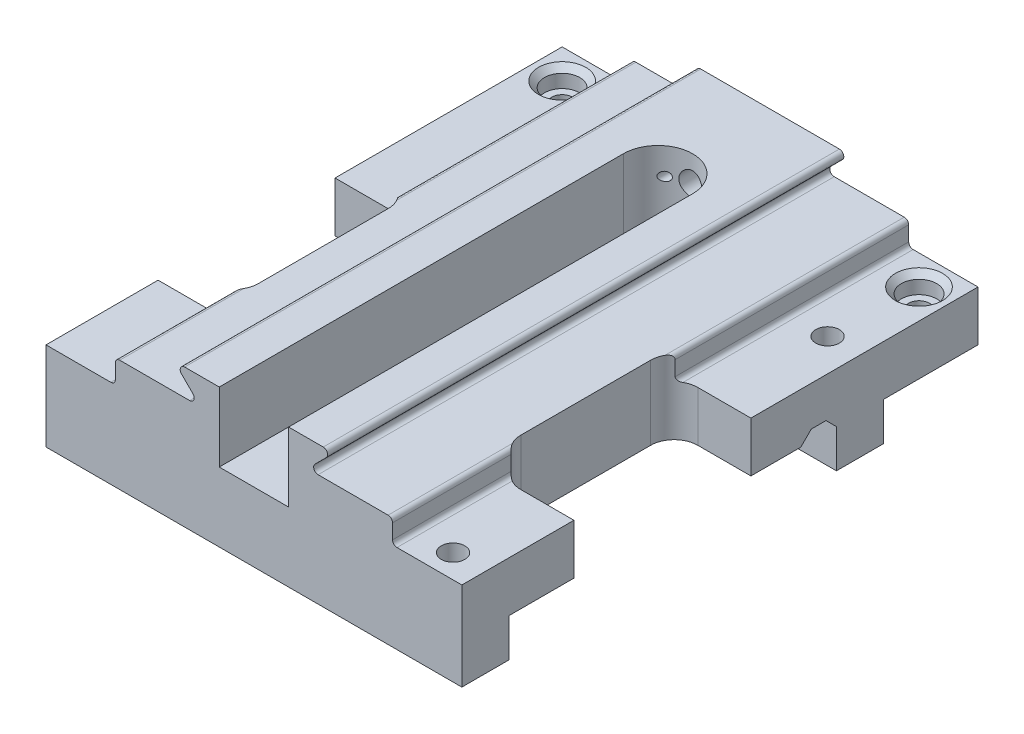
from build123d import *

# Parameters (mm, degrees)
SKETCH1_R               = 4
SKETCH1_R_2             = 1.5
BOSS_EXTRUDE1_DEPTH     = 175
SKETCH2_R               = 6
CUT_EXTRUDE1_DEPTH      = 191.124958909
CUT_EXTRUDE2_DEPTH      = 191.124959013
CUT_EXTRUDE2_DEPTH_BACK = 191.124959013
SKETCH3_R               = 3.5
SKETCH3_R_2             = 5
CUT_EXTRUDE3_DEPTH      = 191.124959013
CUT_EXTRUDE3_DEPTH_BACK = 191.124959013
SKETCH4_W               = 32
SKETCH4_H               = 13
CHAMFER1_SIZE           = 2
SKETCH5_R               = 3.5
BOSS_EXTRUDE2_DEPTH     = 22
SKETCH6_R               = 4
SKETCH6_R_2             = 2.25
CUT_EXTRUDE4_DEPTH      = 18
CUT_EXTRUDE5_DEPTH      = 192.037300114
CUT_EXTRUDE5_DEPTH_BACK = 192.037300114
SKETCH6_2_R             = 2.25


with BuildPart() as part:
    # Sketch1 → Boss-Extrude1 (new body)
    with BuildSketch(Plane.XY):
        with BuildLine():
            Line((24.560660172, 20.939339828), (20.681980515, 17.060660172))
            ThreePointArc((20.681980515, 17.060660172), (20.356821388, 15.425974851), (21.742640687, 14.5))
            Line((21.742640687, 14.5), (45.5, 14.5))
            ThreePointArc((45.5, 14.5), (46.560660172, 14.060660172), (47, 13))
            Line((47, 13), (47, 8))
            ThreePointArc((47, 8), (47.439339828, 6.939339828), (48.5, 6.5))
            Line((48.5, 6.5), (70.5, 6.5))
            Line((70.5, 6.5), (70.5, -23.5))
            Line((70.5, -23.5), (-70.5, -23.5))
            Line((-70.5, -23.5), (-70.5, 6.5))
            Line((-70.5, 6.5), (-48.5, 6.5))
            ThreePointArc((-48.5, 6.5), (-47.439339828, 6.939339828), (-47, 8))
            Line((-47, 8), (-47, 13))
            ThreePointArc((-47, 13), (-46.560660172, 14.060660172), (-45.5, 14.5))
            Line((-45.5, 14.5), (-21.742640687, 14.5))
            ThreePointArc((-21.742640687, 14.5), (-20.356821388, 15.425974851), (-20.681980515, 17.060660172))
            Line((-20.681980515, 17.060660172), (-24.560660172, 20.939339828))
            ThreePointArc((-24.560660172, 20.939339828), (-24.885819299, 22.574025149), (-23.5, 23.5))
            Line((-23.5, 23.5), (23.5, 23.5))
            ThreePointArc((23.5, 23.5), (24.885819299, 22.574025149), (24.560660172, 20.939339828))
        make_face()
        with Locations((0, 14.5)):
            Circle(SKETCH1_R, mode=Mode.SUBTRACT)
        with Locations((7, 14.5)):
            Circle(SKETCH1_R_2, mode=Mode.SUBTRACT)
        with Locations((-7, 14.5)):
            Circle(SKETCH1_R_2, mode=Mode.SUBTRACT)
    extrude(amount=-BOSS_EXTRUDE1_DEPTH)

    # Sketch2 → Cut-Extrude1 (cut, through all)
    with BuildSketch(Plane(origin=(0, 0, 0), x_dir=(1, 0, 0), z_dir=(0, 1, 0))):
        with Locations((-60.5, 165)):
            Circle(SKETCH2_R)
        with Locations((60.5, 165)):
            Circle(SKETCH2_R)
        with BuildLine():
            Line((-11.75, 0), (-11.75, 137))
            ThreePointArc((-11.75, 137), (0, 148.75), (11.75, 137))
            Line((11.75, 137), (11.75, 0))
            ThreePointArc((11.75, 0), (0, -11.75), (-11.75, 0))
        make_face()
    extrude(amount=CUT_EXTRUDE1_DEPTH, mode=Mode.SUBTRACT)

    # Sketch3 → Cut-Extrude2 (cut, two sides: drawn at the far end of the back side and taken through both)
    with BuildSketch(Plane(origin=(0, 0, 0), x_dir=(1, 0, 0), z_dir=(0, 1, 0)).offset(-CUT_EXTRUDE2_DEPTH_BACK)):
        with Locations((-60.5, 165)):
            Circle(SKETCH3_R)
        with Locations((0, 24)):
            Circle(SKETCH3_R_2)
        with Locations((60.5, 165)):
            Circle(SKETCH3_R)
        with BuildLine():
            Line((-70.5, 98), (-52.5, 98))
            ThreePointArc((-52.5, 98), (-46.843145751, 95.656854249), (-44.5, 90))
            Line((-44.5, 90), (-44.5, 46))
            ThreePointArc((-44.5, 46), (-46.843145751, 40.343145751), (-52.5, 38))
            Line((-52.5, 38), (-70.5, 38))
            Line((-70.5, 38), (-70.5, 98))
        make_face()
        with BuildLine():
            Line((70.5, 38), (70.5, 98))
            Line((70.5, 98), (52.5, 98))
            ThreePointArc((52.5, 98), (46.843145751, 95.656854249), (44.5, 90))
            Line((44.5, 90), (44.5, 46))
            ThreePointArc((44.5, 46), (46.843145751, 40.343145751), (52.5, 38))
            Line((52.5, 38), (70.5, 38))
        make_face()
    extrude(amount=CUT_EXTRUDE2_DEPTH + CUT_EXTRUDE2_DEPTH_BACK, mode=Mode.SUBTRACT)

    # Sketch4 → Cut-Extrude3 (cut, two sides: drawn at the far end of the back side and taken through both)
    with BuildSketch(Plane(origin=(0, 0, 0), x_dir=(0, 0, -1), z_dir=(1, 0, 0)).offset(-CUT_EXTRUDE3_DEPTH_BACK)):
        with Locations((159, -17)):
            Rectangle(SKETCH4_W, SKETCH4_H)
        Polygon((127, -23.5), (127, -10.5), (123.464466094, -6.964466094), (118.464466094, -6.964466094), (114.928932188, -10.5), (16, -10.5), (16, -23.5), align=None)
    extrude(amount=CUT_EXTRUDE3_DEPTH + CUT_EXTRUDE3_DEPTH_BACK, mode=Mode.SUBTRACT)

    # Chamfer1
    chamfer1_edges = [part.edges().sort_by_distance(p)[0] for p in [
        (-5, 0, -24),
        (-66.5, 6.5, -165),
        (54.5, 6.5, -165),
    ]]
    chamfer(chamfer1_edges, length=CHAMFER1_SIZE)

    # Sketch5 → Boss-Extrude2 (add, symmetric)
    with BuildSketch(Plane(origin=(0, 0, 0), x_dir=(0, 0, -1), z_dir=(1, 0, 0))):
        Polygon((118.464466094, -19.035533906), (127, -19.035533906), (127, -10.5), (123.464466094, -6.964466094), (118.464466094, -6.964466094), (114.928932188, -10.5), (114.928932188, -15.5), align=None)
        with Locations((120.964466094, -13)):
            Circle(SKETCH5_R, mode=Mode.SUBTRACT)
    extrude(amount=BOSS_EXTRUDE2_DEPTH, both=True)

    # Sketch6 → Cut-Extrude4 (cut)
    # profile 1 of 2: a face of its own
    with BuildSketch(Plane(origin=(0, 6.5, 0), x_dir=(1, 0, 0), z_dir=(0, 1, 0))):
        with Locations((59.5, 8)):
            Circle(SKETCH6_R)
        with Locations((59.5, 8)):
            Circle(SKETCH6_R_2, mode=Mode.SUBTRACT)
    # profile 2 of 2: a face of its own
    with BuildSketch(Plane(origin=(0, 6.5, 0), x_dir=(1, 0, 0), z_dir=(0, 1, 0))):
        with Locations((59.5, 135)):
            Circle(SKETCH6_R)
        with Locations((59.5, 135)):
            Circle(SKETCH6_R_2, mode=Mode.SUBTRACT)
    extrude(amount=-CUT_EXTRUDE4_DEPTH, mode=Mode.SUBTRACT)

    # Sketch6<2> → Cut-Extrude5 (cut, two sides: drawn at the far end of the back side and taken through both)
    with BuildSketch(Plane(origin=(0, 6.5, 0), x_dir=(1, 0, 0), z_dir=(0, 1, 0)).offset(-CUT_EXTRUDE5_DEPTH_BACK)):
        with Locations((59.5, 8)):
            Circle(SKETCH6_2_R)
        with Locations((59.5, 135)):
            Circle(SKETCH6_2_R)
    extrude(amount=CUT_EXTRUDE5_DEPTH + CUT_EXTRUDE5_DEPTH_BACK, mode=Mode.SUBTRACT)


solid = part.part
